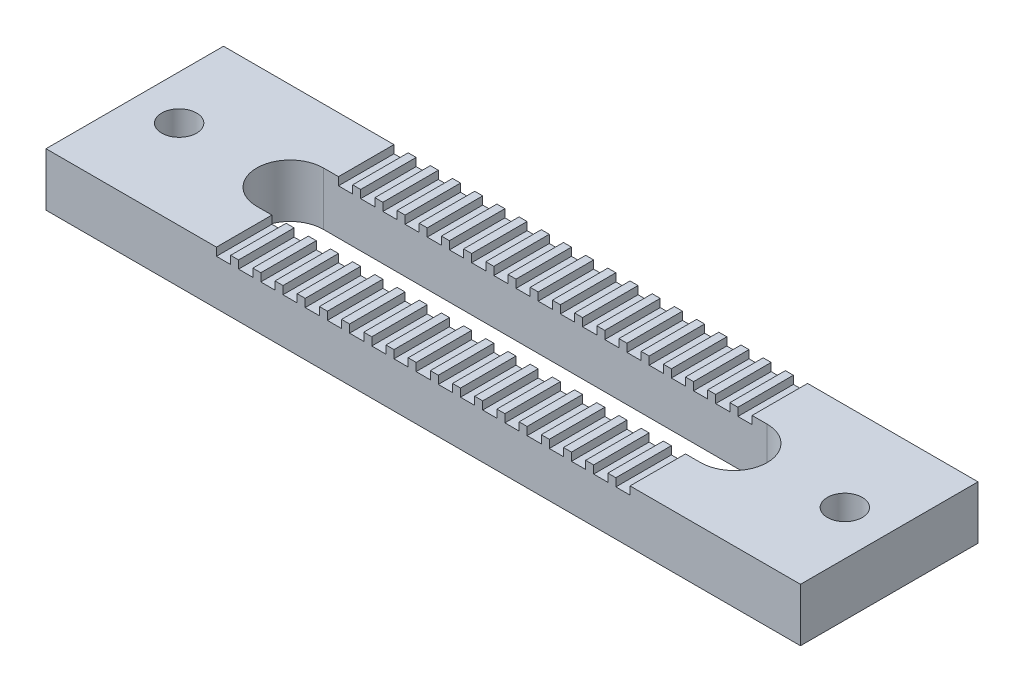
from build123d import *

# Parameters (mm, degrees)
SKETCH1_W                = 107.95
SKETCH1_H                = 25.4
BOSS_EXTRUDE1_DEPTH      = 7.62
SKETCH2_W                = 2.032
SKETCH2_H                = 25.4
CUT_EXTRUDE1_DEPTH       = 1.143
LPATTERN1_COUNT          = 10
LPATTERN1_PITCH          = 3.175
MIRROR1_COPY_1_SKETCH_W  = 2.032
MIRROR1_COPY_1_SKETCH_H  = 25.4
MIRROR1_COPY_1_DEPTH     = 1.143
MIRROR1_COPY_2_SKETCH_W  = 2.032
MIRROR1_COPY_2_SKETCH_H  = 25.4
MIRROR1_COPY_2_DEPTH     = 1.143
MIRROR1_COPY_3_SKETCH_W  = 2.032
MIRROR1_COPY_3_SKETCH_H  = 25.4
MIRROR1_COPY_3_DEPTH     = 1.143
MIRROR1_COPY_4_SKETCH_W  = 2.032
MIRROR1_COPY_4_SKETCH_H  = 25.4
MIRROR1_COPY_4_DEPTH     = 1.143
MIRROR1_COPY_5_SKETCH_W  = 2.032
MIRROR1_COPY_5_SKETCH_H  = 25.4
MIRROR1_COPY_5_DEPTH     = 1.143
MIRROR1_COPY_6_SKETCH_W  = 2.032
MIRROR1_COPY_6_SKETCH_H  = 25.4
MIRROR1_COPY_6_DEPTH     = 1.143
MIRROR1_COPY_7_SKETCH_W  = 2.032
MIRROR1_COPY_7_SKETCH_H  = 25.4
MIRROR1_COPY_7_DEPTH     = 1.143
MIRROR1_COPY_8_SKETCH_W  = 2.032
MIRROR1_COPY_8_SKETCH_H  = 25.4
MIRROR1_COPY_8_DEPTH     = 1.143
MIRROR1_COPY_9_SKETCH_W  = 2.032
MIRROR1_COPY_9_SKETCH_H  = 25.4
MIRROR1_COPY_9_DEPTH     = 1.143
MIRROR1_COPY_10_SKETCH_W = 2.032
MIRROR1_COPY_10_SKETCH_H = 25.4
MIRROR1_COPY_10_DEPTH    = 1.143
SKETCH3_R                = 2.499995
CUT_EXTRUDE2_DEPTH       = 56.970126184


with BuildPart() as part:
    # Sketch1 → Boss-Extrude1 (new body)
    with BuildSketch(Plane(origin=(0, 0, 0), x_dir=(1, 0, 0), z_dir=(0, 1, 0))):
        Rectangle(SKETCH1_W, SKETCH1_H)
        with BuildLine():
            Line((-31.75, 4.7625), (31.75, 4.7625))
            ThreePointArc((31.75, 4.7625), (36.5125, 0), (31.75, -4.7625))
            Line((31.75, -4.7625), (-31.75, -4.7625))
            ThreePointArc((-31.75, -4.7625), (-36.5125, 0), (-31.75, 4.7625))
        make_face(mode=Mode.SUBTRACT)
    extrude(amount=BOSS_EXTRUDE1_DEPTH)

    # Sketch2 → Cut-Extrude1 (cut)
    with BuildSketch(Plane(origin=(0, 7.62, 0), x_dir=(1, 0, 0), z_dir=(0, 1, 0))):
        Rectangle(SKETCH2_W, SKETCH2_H)
    cut_extrude1 = extrude(amount=-CUT_EXTRUDE1_DEPTH, mode=Mode.SUBTRACT)

    # LPattern1: Cut-Extrude1 ×10
    with Locations(*[(i * LPATTERN1_PITCH, 0, 0) for i in range(1, LPATTERN1_COUNT)]):
        add(cut_extrude1, mode=Mode.SUBTRACT)

    # Mirror1 copy 1 sketch → Mirror1 copy 1 (cut)
    with BuildSketch(Plane(origin=(-3.175, 7.62, 0), x_dir=(-1, 0, 0), z_dir=(0, 1, 0))):
        Rectangle(MIRROR1_COPY_1_SKETCH_W, MIRROR1_COPY_1_SKETCH_H)
    extrude(amount=-MIRROR1_COPY_1_DEPTH, mode=Mode.SUBTRACT)

    # Mirror1 copy 2 sketch → Mirror1 copy 2 (cut)
    with BuildSketch(Plane(origin=(-6.35, 7.62, 0), x_dir=(-1, 0, 0), z_dir=(0, 1, 0))):
        Rectangle(MIRROR1_COPY_2_SKETCH_W, MIRROR1_COPY_2_SKETCH_H)
    extrude(amount=-MIRROR1_COPY_2_DEPTH, mode=Mode.SUBTRACT)

    # Mirror1 copy 3 sketch → Mirror1 copy 3 (cut)
    with BuildSketch(Plane(origin=(-9.525, 7.62, 0), x_dir=(-1, 0, 0), z_dir=(0, 1, 0))):
        Rectangle(MIRROR1_COPY_3_SKETCH_W, MIRROR1_COPY_3_SKETCH_H)
    extrude(amount=-MIRROR1_COPY_3_DEPTH, mode=Mode.SUBTRACT)

    # Mirror1 copy 4 sketch → Mirror1 copy 4 (cut)
    with BuildSketch(Plane(origin=(-12.7, 7.62, 0), x_dir=(-1, 0, 0), z_dir=(0, 1, 0))):
        Rectangle(MIRROR1_COPY_4_SKETCH_W, MIRROR1_COPY_4_SKETCH_H)
    extrude(amount=-MIRROR1_COPY_4_DEPTH, mode=Mode.SUBTRACT)

    # Mirror1 copy 5 sketch → Mirror1 copy 5 (cut)
    with BuildSketch(Plane(origin=(-15.875, 7.62, 0), x_dir=(-1, 0, 0), z_dir=(0, 1, 0))):
        Rectangle(MIRROR1_COPY_5_SKETCH_W, MIRROR1_COPY_5_SKETCH_H)
    extrude(amount=-MIRROR1_COPY_5_DEPTH, mode=Mode.SUBTRACT)

    # Mirror1 copy 6 sketch → Mirror1 copy 6 (cut)
    with BuildSketch(Plane(origin=(-19.05, 7.62, 0), x_dir=(-1, 0, 0), z_dir=(0, 1, 0))):
        Rectangle(MIRROR1_COPY_6_SKETCH_W, MIRROR1_COPY_6_SKETCH_H)
    extrude(amount=-MIRROR1_COPY_6_DEPTH, mode=Mode.SUBTRACT)

    # Mirror1 copy 7 sketch → Mirror1 copy 7 (cut)
    with BuildSketch(Plane(origin=(-22.225, 7.62, 0), x_dir=(-1, 0, 0), z_dir=(0, 1, 0))):
        Rectangle(MIRROR1_COPY_7_SKETCH_W, MIRROR1_COPY_7_SKETCH_H)
    extrude(amount=-MIRROR1_COPY_7_DEPTH, mode=Mode.SUBTRACT)

    # Mirror1 copy 8 sketch → Mirror1 copy 8 (cut)
    with BuildSketch(Plane(origin=(-25.4, 7.62, 0), x_dir=(-1, 0, 0), z_dir=(0, 1, 0))):
        Rectangle(MIRROR1_COPY_8_SKETCH_W, MIRROR1_COPY_8_SKETCH_H)
    extrude(amount=-MIRROR1_COPY_8_DEPTH, mode=Mode.SUBTRACT)

    # Mirror1 copy 9 sketch → Mirror1 copy 9 (cut)
    with BuildSketch(Plane(origin=(-28.575, 7.62, 0), x_dir=(-1, 0, 0), z_dir=(0, 1, 0))):
        Rectangle(MIRROR1_COPY_9_SKETCH_W, MIRROR1_COPY_9_SKETCH_H)
    extrude(amount=-MIRROR1_COPY_9_DEPTH, mode=Mode.SUBTRACT)

    # Mirror1 copy 10 sketch → Mirror1 copy 10 (cut)
    with BuildSketch(Plane(origin=(0, 7.62, 0), x_dir=(-1, 0, 0), z_dir=(0, 1, 0))):
        Rectangle(MIRROR1_COPY_10_SKETCH_W, MIRROR1_COPY_10_SKETCH_H)
    extrude(amount=-MIRROR1_COPY_10_DEPTH, mode=Mode.SUBTRACT)

    # Sketch3 → Cut-Extrude2 (cut, through all)
    with BuildSketch(Plane(origin=(0, 7.62, 0), x_dir=(1, 0, 0), z_dir=(0, 1, 0))):
        with Locations(Location((-47.625, 0, 0), (0, 0, 270))):
            Circle(SKETCH3_R)
        with Locations(Location((47.625, 0, 0), (0, 0, 270))):
            Circle(SKETCH3_R)
    extrude(amount=-CUT_EXTRUDE2_DEPTH, mode=Mode.SUBTRACT)


solid = part.part
